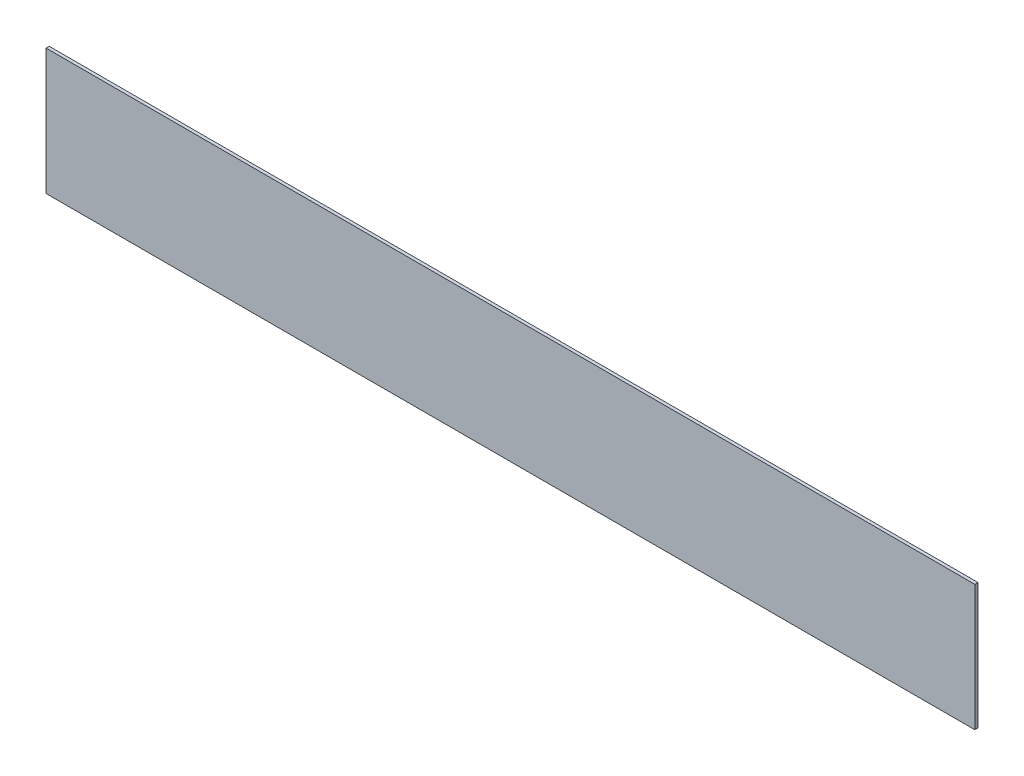
from build123d import *

# Parameters (mm, degrees)
SKETCH1_W           = 590
SKETCH1_H           = 80
BOSS_EXTRUDE1_DEPTH = 2


with BuildPart() as part:
    # Sketch1 → Boss-Extrude1 (new body)
    with BuildSketch(Plane.XY):
        with Locations((295, -40)):
            Rectangle(SKETCH1_W, SKETCH1_H)
    extrude(amount=BOSS_EXTRUDE1_DEPTH)


solid = part.part
